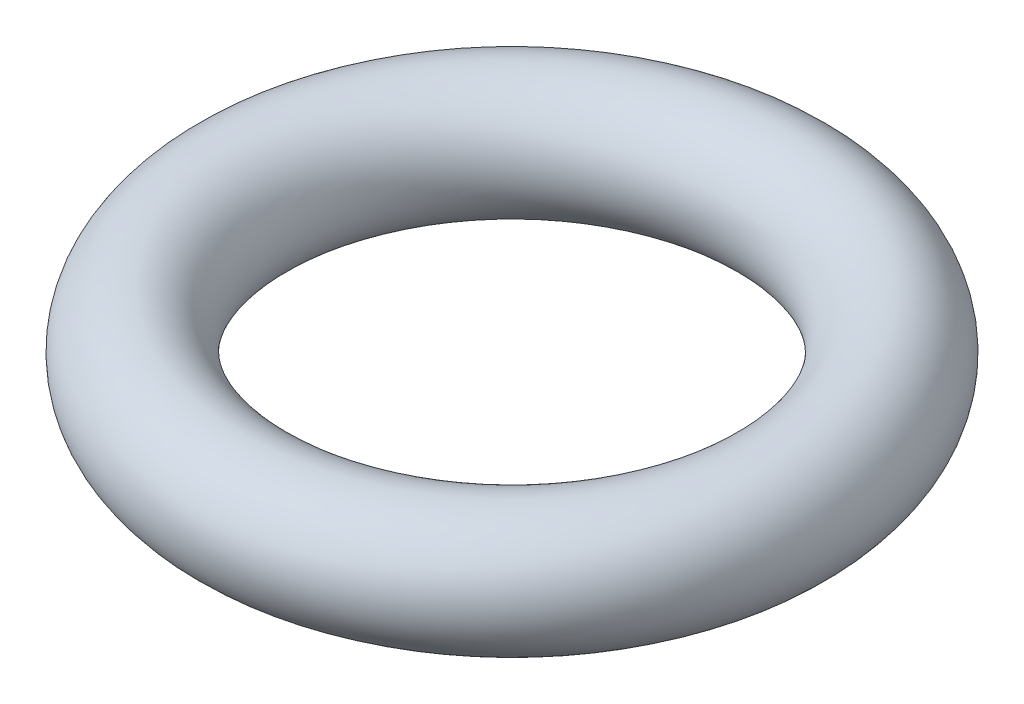
from build123d import *

# Parameters (mm, degrees)
SKETCH_1_R = 1.25


with BuildPart() as part:
    # 草图1 → 旋转1 (revolve)
    with BuildSketch(Plane.XY, mode=Mode.PRIVATE) as revolve_1_sk:
        with Locations((-5.5, 0)):
            Circle(SKETCH_1_R)
    revolve(revolve_1_sk.sketch.rotate(Axis((0, 0, 0), (0, 1, 0)), 270), axis=Axis((0, 0, 0), (0, 1, 0)))


solid = part.part
